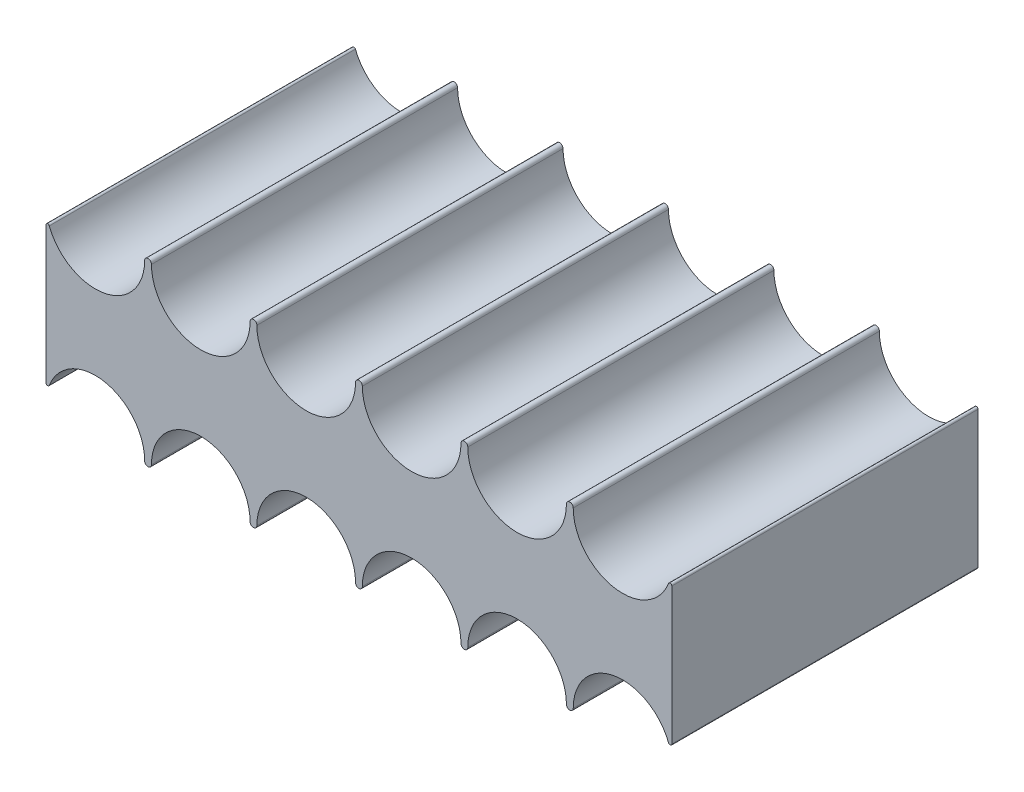
from build123d import *

# Parameters (mm, degrees)
BOSS_EXTRU_1_DEPTH = 45


with BuildPart() as part:
    # Esquisse1 → Boss.-Extru.1 (new body)
    with BuildSketch(Plane.XY):
        with BuildLine():
            Line((-46, 10.057417596), (-46, -10.057417596))
            ThreePointArc((-46, -10.057417596), (-45.795643546, -10.303215616), (-45.516666667, -10.147170343))
            ThreePointArc((-45.516666667, -10.147170343), (-37.426337153, -5.621857418), (-31.5, -12.75))
            ThreePointArc((-31.5, -12.75), (-31, -13.25), (-30.5, -12.75))
            ThreePointArc((-30.5, -12.75), (-23.25, -5.5), (-16, -12.75))
            ThreePointArc((-16, -12.75), (-15.5, -13.25), (-15, -12.75))
            ThreePointArc((-15, -12.75), (-7.75, -5.5), (-0.5, -12.75))
            ThreePointArc((-0.5, -12.75), (0, -13.25), (0.5, -12.75))
            ThreePointArc((0.5, -12.75), (7.75, -5.5), (15, -12.75))
            ThreePointArc((15, -12.75), (15.5, -13.25), (16, -12.75))
            ThreePointArc((16, -12.75), (23.25, -5.5), (30.5, -12.75))
            ThreePointArc((30.5, -12.75), (31, -13.25), (31.5, -12.75))
            ThreePointArc((31.5, -12.75), (37.426337153, -5.621857418), (45.516666667, -10.147170343))
            ThreePointArc((45.516666667, -10.147170343), (45.795643546, -10.303215616), (46, -10.057417596))
            Line((46, -10.057417596), (46, 10.057417596))
            ThreePointArc((46, 10.057417596), (45.795643546, 10.303215616), (45.516666667, 10.147170343))
            ThreePointArc((45.516666667, 10.147170343), (37.426337153, 5.621857418), (31.5, 12.75))
            ThreePointArc((31.5, 12.75), (31, 13.25), (30.5, 12.75))
            ThreePointArc((30.5, 12.75), (23.25, 5.5), (16, 12.75))
            ThreePointArc((16, 12.75), (15.5, 13.25), (15, 12.75))
            ThreePointArc((15, 12.75), (7.75, 5.5), (0.5, 12.75))
            ThreePointArc((0.5, 12.75), (0, 13.25), (-0.5, 12.75))
            ThreePointArc((-0.5, 12.75), (-7.75, 5.5), (-15, 12.75))
            ThreePointArc((-15, 12.75), (-15.5, 13.25), (-16, 12.75))
            ThreePointArc((-16, 12.75), (-23.25, 5.5), (-30.5, 12.75))
            ThreePointArc((-30.5, 12.75), (-31, 13.25), (-31.5, 12.75))
            ThreePointArc((-31.5, 12.75), (-37.426337153, 5.621857418), (-45.516666667, 10.147170343))
            ThreePointArc((-45.516666667, 10.147170343), (-45.795643546, 10.303215616), (-46, 10.057417596))
        make_face()
    extrude(amount=BOSS_EXTRU_1_DEPTH)


solid = part.part
